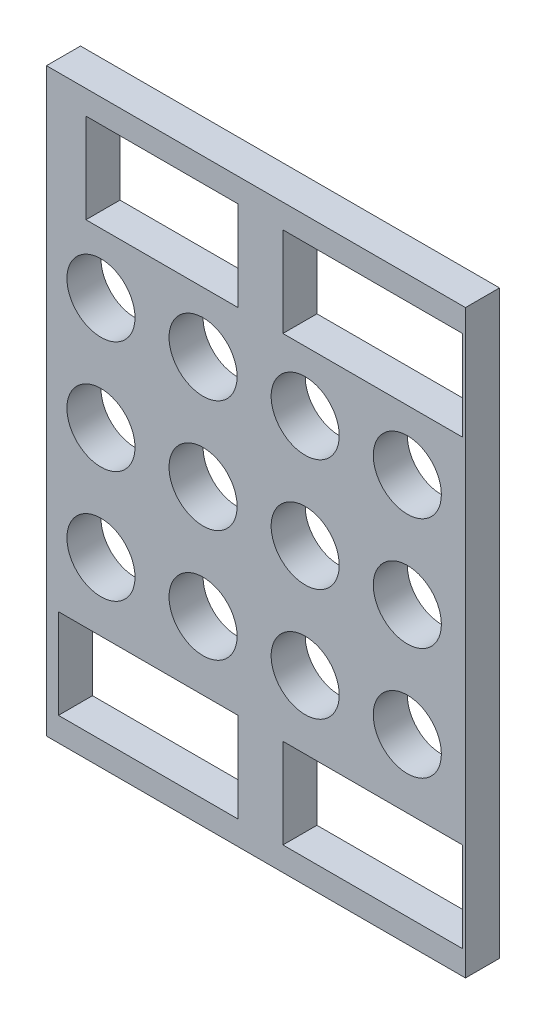
from build123d import *

# Parameters (mm, degrees)
SKETCH1_W           = 61.542579433
SKETCH1_H           = 85.2804315
SKETCH1_R           = 5
SKETCH1_W_2         = 22.337231555
SKETCH1_H_2         = 13.187695593
SKETCH1_W_3         = 26.375391186
BOSS_EXTRUDE1_DEPTH = 5


with BuildPart() as part:
    # Sketch1 → Boss-Extrude1 (new body)
    with BuildSketch(Plane.XY):
        with Locations((254.240343952, 391.464524612)):
            Rectangle(SKETCH1_W, SKETCH1_H)
        with Locations((231.469054236, 408.546029818)):
            Circle(SKETCH1_R, mode=Mode.SUBTRACT)
        with Locations((246.469054236, 408.546029818)):
            Circle(SKETCH1_R, mode=Mode.SUBTRACT)
        with Locations((261.469054236, 408.546029818)):
            Circle(SKETCH1_R, mode=Mode.SUBTRACT)
        with Locations((276.469054236, 408.546029818)):
            Circle(SKETCH1_R, mode=Mode.SUBTRACT)
        with Locations((231.469054236, 392.046029818)):
            Circle(SKETCH1_R, mode=Mode.SUBTRACT)
        with Locations((246.469054236, 392.046029818)):
            Circle(SKETCH1_R, mode=Mode.SUBTRACT)
        with Locations((261.469054236, 392.046029818)):
            Circle(SKETCH1_R, mode=Mode.SUBTRACT)
        with Locations((276.469054236, 392.046029818)):
            Circle(SKETCH1_R, mode=Mode.SUBTRACT)
        with Locations((231.469054236, 375.546029818)):
            Circle(SKETCH1_R, mode=Mode.SUBTRACT)
        with Locations((246.469054236, 375.546029818)):
            Circle(SKETCH1_R, mode=Mode.SUBTRACT)
        with Locations((261.469054236, 375.546029818)):
            Circle(SKETCH1_R, mode=Mode.SUBTRACT)
        with Locations((276.469054236, 375.546029818)):
            Circle(SKETCH1_R, mode=Mode.SUBTRACT)
        with Locations((240.434189057, 423.994173741)):
            Rectangle(SKETCH1_W_2, SKETCH1_H_2, mode=Mode.SUBTRACT)
        with Locations((271.384348223, 423.994173741)):
            Rectangle(SKETCH1_W_3, SKETCH1_H_2, mode=Mode.SUBTRACT)
        with Locations((238.415109241, 358.934875483)):
            Rectangle(SKETCH1_W_3, SKETCH1_H_2, mode=Mode.SUBTRACT)
        with Locations((271.384348223, 358.934875483)):
            Rectangle(SKETCH1_W_3, SKETCH1_H_2, mode=Mode.SUBTRACT)
    extrude(amount=BOSS_EXTRUDE1_DEPTH)


solid = part.part
